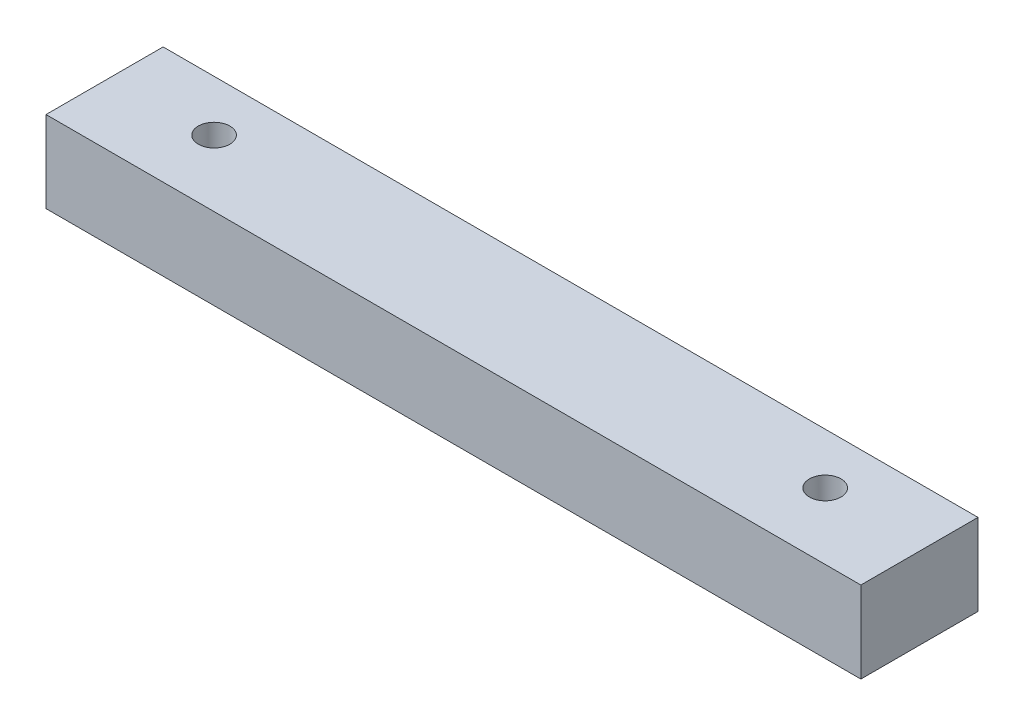
from build123d import *

# Parameters (mm, degrees)
SKETCH_1_W          = 80
SKETCH_1_H          = 8
EXTRUDE_1_DEPTH     = 11.5
CUT_EXTRUDE_1_REACH = 83.217
SKETCH_2_R          = 1.55


with BuildPart() as part:
    # 草图1 → 凸台-拉伸1 (new body)
    with BuildSketch(Plane.XY):
        with Locations((40, 4)):
            Rectangle(SKETCH_1_W, SKETCH_1_H)
    extrude(amount=EXTRUDE_1_DEPTH)

    # 草图2 → 切除-拉伸1 (cut, up to next)
    with BuildSketch(Plane(origin=(0, 8, 0), x_dir=(1, 0, 0), z_dir=(0, 1, 0)), mode=Mode.PRIVATE) as cut_extrude_1_sk1:
        with Locations(Location((10, -5, 0), (0, 0, 270))):
            Circle(SKETCH_2_R)
    cut_extrude_1_tool1 = extrude(cut_extrude_1_sk1.sketch, amount=-CUT_EXTRUDE_1_REACH, mode=Mode.PRIVATE) & part.part
    # 草图2 → 切除-拉伸1 (cut, up to next)
    with BuildSketch(Plane(origin=(0, 8, 0), x_dir=(1, 0, 0), z_dir=(0, 1, 0)), mode=Mode.PRIVATE) as cut_extrude_1_sk2:
        with Locations(Location((70, -5, 0), (0, 0, 270))):
            Circle(SKETCH_2_R)
    cut_extrude_1_tool2 = extrude(cut_extrude_1_sk2.sketch, amount=-CUT_EXTRUDE_1_REACH, mode=Mode.PRIVATE) & part.part
    add(cut_extrude_1_tool1.solids().sort_by_distance((10, 8, 5))[0], mode=Mode.SUBTRACT)
    add(cut_extrude_1_tool2.solids().sort_by_distance((70, 8, 5))[0], mode=Mode.SUBTRACT)


solid = part.part
